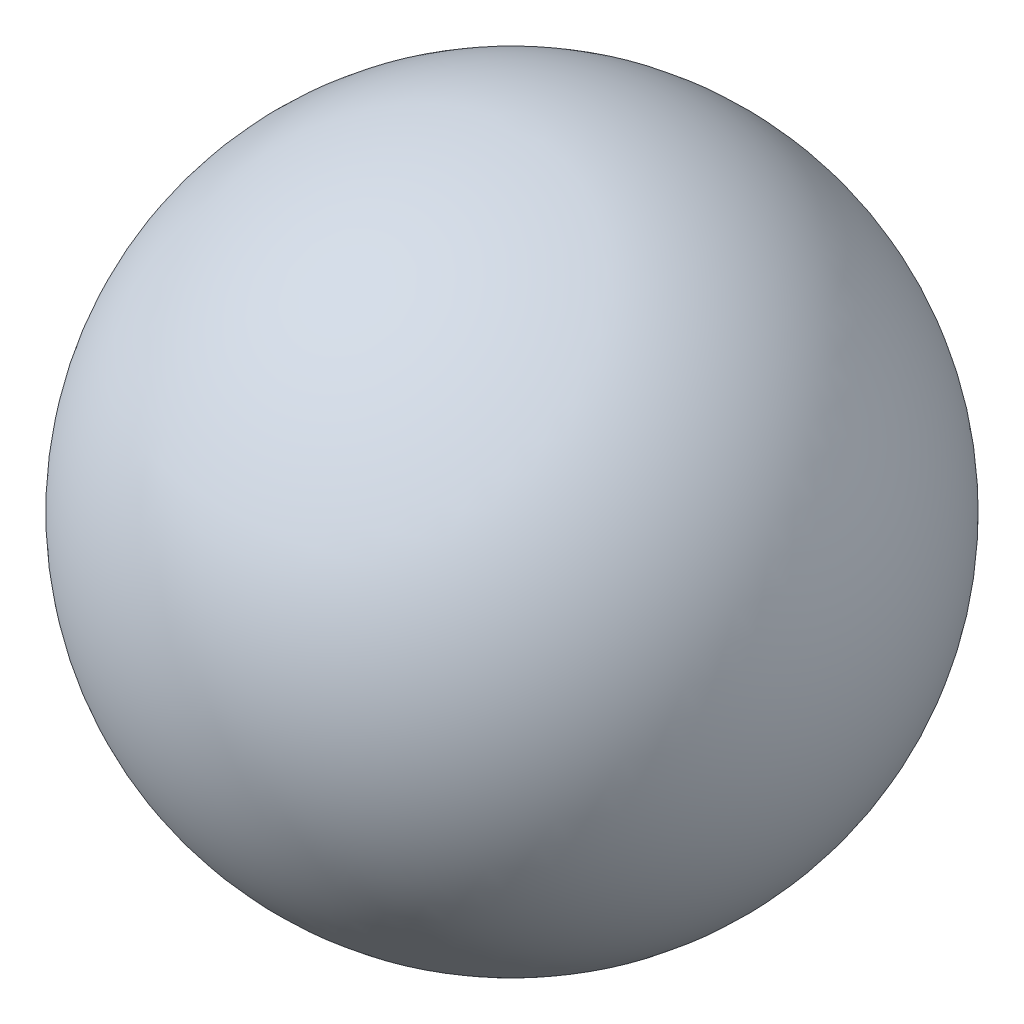
from build123d import *


with BuildPart() as part:
    # Sketch1 → Revolve1 (revolve)
    with BuildSketch(Plane.XY):
        with BuildLine():
            Line((0, -15.875), (0, 15.875))
            ThreePointArc((0, 15.875), (15.875, 0), (0, -15.875))
        make_face()
    revolve(axis=Axis((0, -15.875, 0), (0, 1, 0)))


solid = part.part
